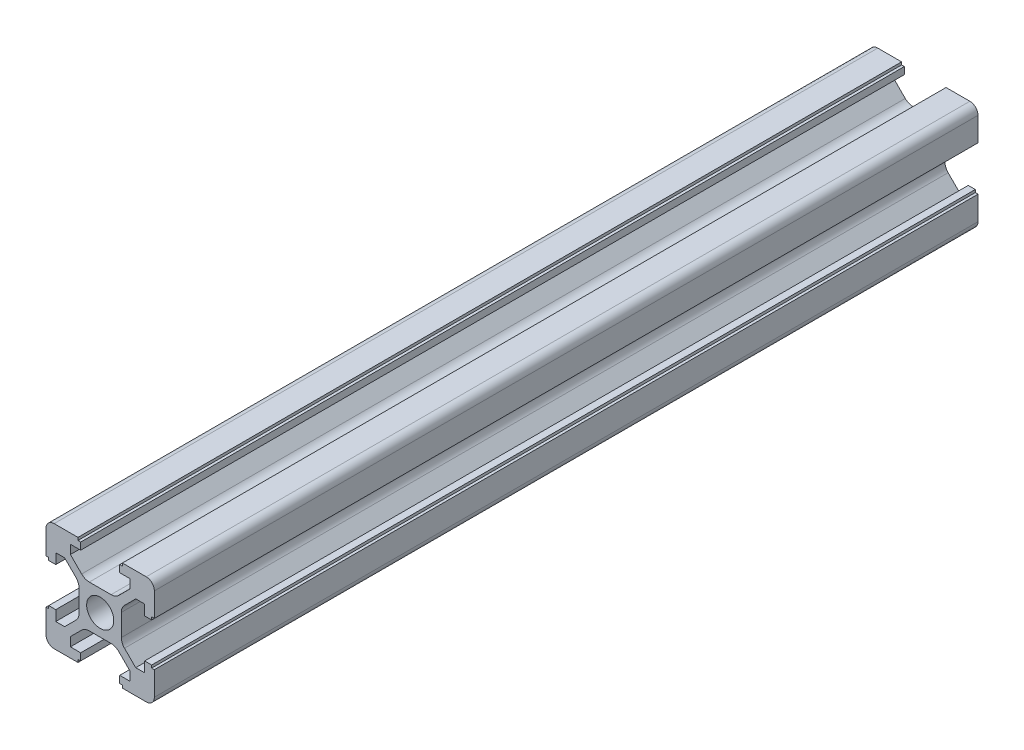
from build123d import *

# Parameters (mm, degrees)
SKETCH1_R           = 2.5
BOSS_EXTRUDE2_DEPTH = 152


with BuildPart() as part:
    # Sketch1 → Boss-Extrude2 (new body)
    with BuildSketch(Plane.XY):
        with BuildLine():
            Line((10, -4.1), (10, -8.5))
            ThreePointArc((10, -8.5), (9.560660172, -9.560660172), (8.5, -10))
            Line((8.5, -10), (4.1, -10))
            Line((4.1, -10), (4.1, -9.5))
            Line((4.1, -9.5), (3.6, -9.5))
            Line((3.6, -9.5), (3.6, -8.2))
            Line((3.6, -8.2), (5.5, -8.2))
            Line((5.5, -8.2), (5.5, -6.560660172))
            Line((5.5, -6.560660172), (3.425126266, -4.485786438))
            ThreePointArc((3.425126266, -4.485786438), (2.776279568, -4.052240935), (2.010912703, -3.9))
            Line((2.010912703, -3.9), (-2.010912703, -3.9))
            ThreePointArc((-2.010912703, -3.9), (-2.776279568, -4.052240935), (-3.425126266, -4.485786438))
            Line((-3.425126266, -4.485786438), (-5.5, -6.560660172))
            Line((-5.5, -6.560660172), (-5.5, -8.2))
            Line((-5.5, -8.2), (-3.6, -8.2))
            Line((-3.6, -8.2), (-3.6, -9.5))
            Line((-3.6, -9.5), (-4.1, -9.5))
            Line((-4.1, -9.5), (-4.1, -10))
            Line((-4.1, -10), (-8.5, -10))
            ThreePointArc((-8.5, -10), (-9.560660172, -9.560660172), (-10, -8.5))
            Line((-10, -8.5), (-10, -4.1))
            Line((-10, -4.1), (-9.5, -4.1))
            Line((-9.5, -4.1), (-9.5, -3.6))
            Line((-9.5, -3.6), (-8.2, -3.6))
            Line((-8.2, -3.6), (-8.2, -5.5))
            Line((-8.2, -5.5), (-6.560660172, -5.5))
            Line((-6.560660172, -5.5), (-4.485786438, -3.425126266))
            ThreePointArc((-4.485786438, -3.425126266), (-4.052240935, -2.776279568), (-3.9, -2.010912703))
            Line((-3.9, -2.010912703), (-3.9, 2.010912703))
            ThreePointArc((-3.9, 2.010912703), (-4.052240935, 2.776279568), (-4.485786438, 3.425126266))
            Line((-4.485786438, 3.425126266), (-6.560660172, 5.5))
            Line((-6.560660172, 5.5), (-8.2, 5.5))
            Line((-8.2, 5.5), (-8.2, 3.6))
            Line((-8.2, 3.6), (-9.5, 3.6))
            Line((-9.5, 3.6), (-9.5, 4.1))
            Line((-9.5, 4.1), (-10, 4.1))
            Line((-10, 4.1), (-10, 8.5))
            ThreePointArc((-10, 8.5), (-9.560660172, 9.560660172), (-8.5, 10))
            Line((-8.5, 10), (-4.1, 10))
            Line((-4.1, 10), (-4.1, 9.5))
            Line((-4.1, 9.5), (-3.6, 9.5))
            Line((-3.6, 9.5), (-3.6, 8.2))
            Line((-3.6, 8.2), (-5.5, 8.2))
            Line((-5.5, 8.2), (-5.5, 6.560660172))
            Line((-5.5, 6.560660172), (-3.425126266, 4.485786438))
            ThreePointArc((-3.425126266, 4.485786438), (-2.776279568, 4.052240935), (-2.010912703, 3.9))
            Line((-2.010912703, 3.9), (2.010912703, 3.9))
            ThreePointArc((2.010912703, 3.9), (2.776279568, 4.052240935), (3.425126266, 4.485786438))
            Line((3.425126266, 4.485786438), (5.5, 6.560660172))
            Line((5.5, 6.560660172), (5.5, 8.2))
            Line((5.5, 8.2), (3.6, 8.2))
            Line((3.6, 8.2), (3.6, 9.5))
            Line((3.6, 9.5), (4.1, 9.5))
            Line((4.1, 9.5), (4.1, 10))
            Line((4.1, 10), (8.5, 10))
            ThreePointArc((8.5, 10), (9.560660172, 9.560660172), (10, 8.5))
            Line((10, 8.5), (10, 4.1))
            Line((10, 4.1), (9.5, 4.1))
            Line((9.5, 4.1), (9.5, 3.6))
            Line((9.5, 3.6), (8.2, 3.6))
            Line((8.2, 3.6), (8.2, 5.5))
            Line((8.2, 5.5), (6.560660172, 5.5))
            Line((6.560660172, 5.5), (4.485786438, 3.425126266))
            ThreePointArc((4.485786438, 3.425126266), (4.052240935, 2.776279568), (3.9, 2.010912703))
            Line((3.9, 2.010912703), (3.9, -2.010912703))
            ThreePointArc((3.9, -2.010912703), (4.052240935, -2.776279568), (4.485786438, -3.425126266))
            Line((4.485786438, -3.425126266), (6.560660172, -5.5))
            Line((6.560660172, -5.5), (8.2, -5.5))
            Line((8.2, -5.5), (8.2, -3.6))
            Line((8.2, -3.6), (9.5, -3.6))
            Line((9.5, -3.6), (9.5, -4.1))
            Line((9.5, -4.1), (10, -4.1))
        make_face()
        Circle(SKETCH1_R, mode=Mode.SUBTRACT)
    extrude(amount=BOSS_EXTRUDE2_DEPTH)


solid = part.part
